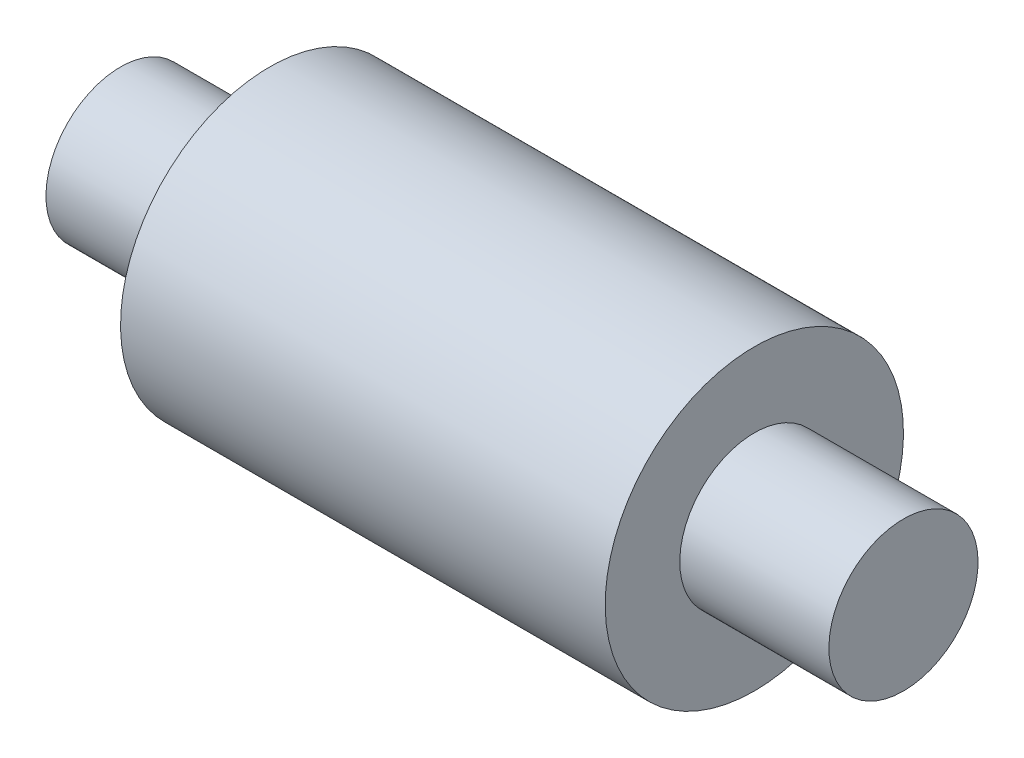
from build123d import *

# Parameters (mm, degrees)
CUT_EXTRUDE_1_DEPTH = 30


with BuildPart() as part:
    # 草图1 → 旋转2 (revolve)
    with BuildSketch(Plane.XY, mode=Mode.PRIVATE) as revolve_2_sk:
        Polygon((0, 2), (0, 0), (17, 0), (21, 0), (21, 2), (17, 2), (17, 4), (4, 4), (4, 2), align=None)
    revolve(revolve_2_sk.sketch.rotate(Axis((-16.701754386, 0, 0), (1, 0, 0)), 180), axis=Axis((-16.701754386, 0, 0), (1, 0, 0)))

    # 草图2 → 切除-拉伸1 (cut)
    with BuildSketch(Plane(origin=(0, 0, 0), x_dir=(1, 0, 0), z_dir=(0, 1, 0))):
        with BuildLine():
            ThreePointArc((11.5, 0), (10.5, 1), (9.5, 0))
            Line((9.5, 0), (11.5, 0))
        make_face()
        with BuildLine():
            Line((11.5, 0), (9.5, 0))
            ThreePointArc((9.5, 0), (10.5, -1), (11.5, 0))
        make_face()
    extrude(amount=-CUT_EXTRUDE_1_DEPTH, mode=Mode.SUBTRACT)


solid = part.part
